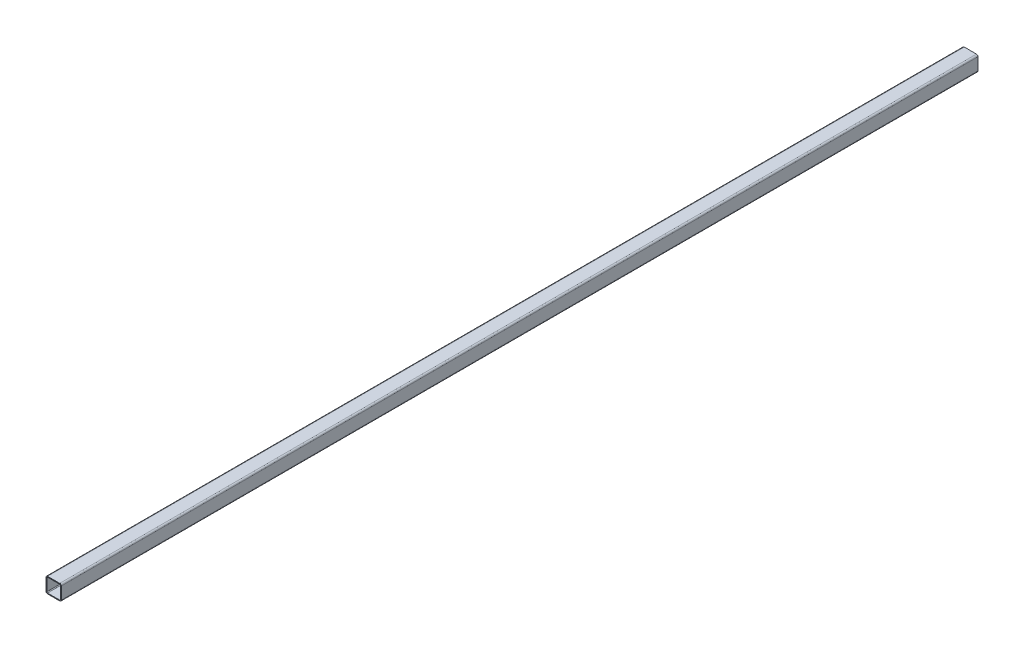
from build123d import *

# Parameters (mm, degrees)
SHS100X100X5_1_DEPTH = 6000


with BuildPart() as part:
    # Sketch11 → SHS100x100x5 (1) (new body)
    with BuildSketch(Plane.XY):
        with BuildLine():
            Line((-40, -50), (40, -50))
            ThreePointArc((40, -50), (47.071067812, -47.071067812), (50, -40))
            Line((50, -40), (50, 40))
            ThreePointArc((50, 40), (47.071067812, 47.071067812), (40, 50))
            Line((40, 50), (-40, 50))
            ThreePointArc((-40, 50), (-47.071067812, 47.071067812), (-50, 40))
            Line((-50, 40), (-50, -40))
            ThreePointArc((-50, -40), (-47.071067812, -47.071067812), (-40, -50))
        make_face()
        with BuildLine():
            Line((-40, -45), (40, -45))
            ThreePointArc((40, -45), (43.535533906, -43.535533906), (45, -40))
            Line((45, -40), (45, 40))
            ThreePointArc((45, 40), (43.535533906, 43.535533906), (40, 45))
            Line((40, 45), (-40, 45))
            ThreePointArc((-40, 45), (-43.535533906, 43.535533906), (-45, 40))
            Line((-45, 40), (-45, -40))
            ThreePointArc((-45, -40), (-43.535533906, -43.535533906), (-40, -45))
        make_face(mode=Mode.SUBTRACT)
    extrude(amount=SHS100X100X5_1_DEPTH)


solid = part.part
